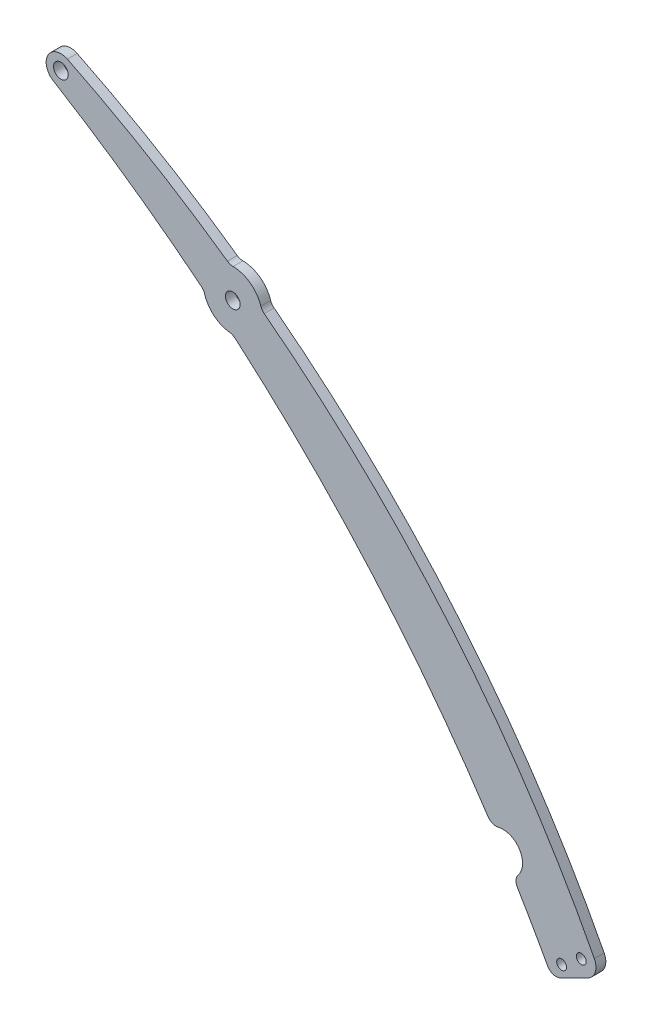
from build123d import *

# Parameters (mm, degrees)
SKETCH_1_R      = 1.5
SKETCH_1_R_2    = 1
EXTRUDE_1_DEPTH = 2


with BuildPart() as part:
    # 草图1 → 凸台-拉伸1 (new body)
    with BuildSketch(Plane.XY):
        with BuildLine():
            Line((107.302513423, -106.329977447), (101.737876551, -109.126595767))
            ThreePointArc((101.737876551, -109.126595767), (100.241041238, -109.247857431), (99.081776454, -108.293223729))
            ThreePointArc((99.081776454, -108.293223729), (96.076157143, -102.895430459), (92.952174798, -97.565265927))
            ThreePointArc((92.952174798, -97.565265927), (92.67119221, -96.396525563), (93.110928625, -95.277804356))
            ThreePointArc((93.110928625, -95.277804356), (93.386262354, -90.634283432), (89.082079375, -88.870167754))
            ThreePointArc((89.082079375, -88.870167754), (87.883298953, -88.781676215), (86.951761021, -88.02197737))
            ThreePointArc((86.951761021, -88.02197737), (63.249240179, -56.927091802), (35.446375502, -29.437055089))
            ThreePointArc((35.446375502, -29.437055089), (34.93756912, -29.118601809), (34.357184804, -28.965466337))
            ThreePointArc((34.357184804, -28.965466337), (31.162596189, -27.612410648), (29.250996223, -24.717252331))
            ThreePointArc((29.250996223, -24.717252331), (28.99483955, -24.174407799), (28.589143834, -23.732019493))
            ThreePointArc((28.589143834, -23.732019493), (13.863721442, -12.651321704), (-1.558710581, -2.56328331))
            ThreePointArc((-1.558710581, -2.56328331), (-2.630799159, 1.441837641), (1.322046154, 2.692989782))
            ThreePointArc((1.322046154, 2.692989782), (17.996215952, -6.326789823), (33.906457747, -16.634484455))
            ThreePointArc((33.906457747, -16.634484455), (34.447529327, -16.904338105), (35.04451896, -17.000165164))
            ThreePointArc((35.04451896, -17.000165164), (38.553058948, -18.165150249), (40.712715331, -21.16563811))
            ThreePointArc((40.712715331, -21.16563811), (40.982462328, -21.706762868), (41.401593445, -22.142547854))
            ThreePointArc((41.401593445, -22.142547854), (79.427798672, -58.499548545), (108.618618094, -102.268485529))
            ThreePointArc((108.618618094, -102.268485529), (108.809267395, -104.574248701), (107.302513423, -106.329977447))
        make_face()
        Circle(SKETCH_1_R, mode=Mode.SUBTRACT)
        with Locations((105.955364791, -103.64945687)):
            Circle(SKETCH_1_R_2, mode=Mode.SUBTRACT)
        with Locations((101.955364791, -106.64945687)):
            Circle(SKETCH_1_R_2, mode=Mode.SUBTRACT)
        with Locations((35, -23)):
            Circle(SKETCH_1_R, mode=Mode.SUBTRACT)
    extrude(amount=EXTRUDE_1_DEPTH)


solid = part.part
